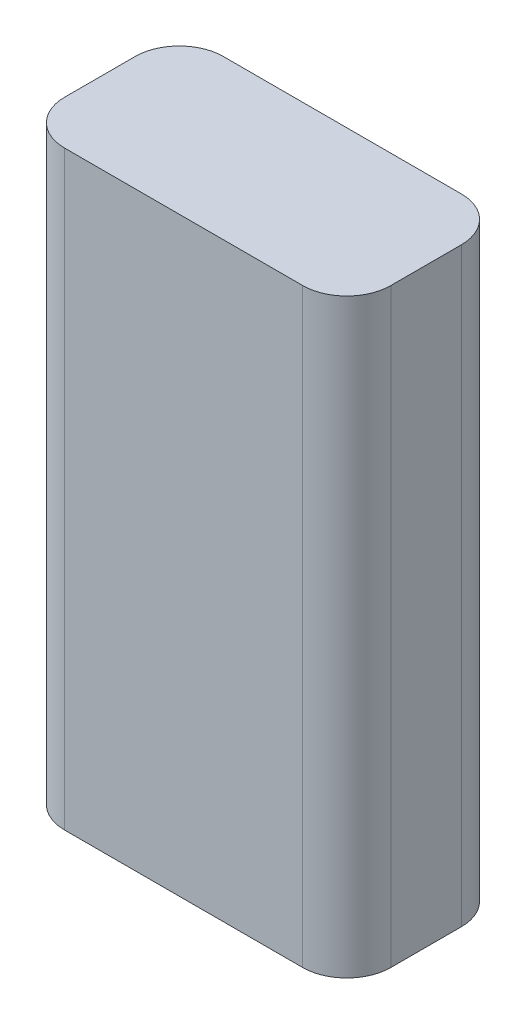
from build123d import *

# Parameters (mm, degrees)
SKETCH_1_W      = 37
SKETCH_1_H      = 67
EXTRUDE_1_DEPTH = 18
FILLET_2_R      = 5


with BuildPart() as part:
    # 草图1 → 凸台-拉伸1 (new body)
    with BuildSketch(Plane.XY):
        Rectangle(SKETCH_1_W, SKETCH_1_H)
    extrude(amount=EXTRUDE_1_DEPTH)

    # 圆角2
    fillet_2_edges = [part.edges().sort_by_distance(p)[0] for p in [
        (-18.5, 0, 18),
        (18.5, 0, 18),
        (-18.5, 0, 0),
        (18.5, 0, 0),
    ]]
    fillet(fillet_2_edges, radius=FILLET_2_R)


solid = part.part
